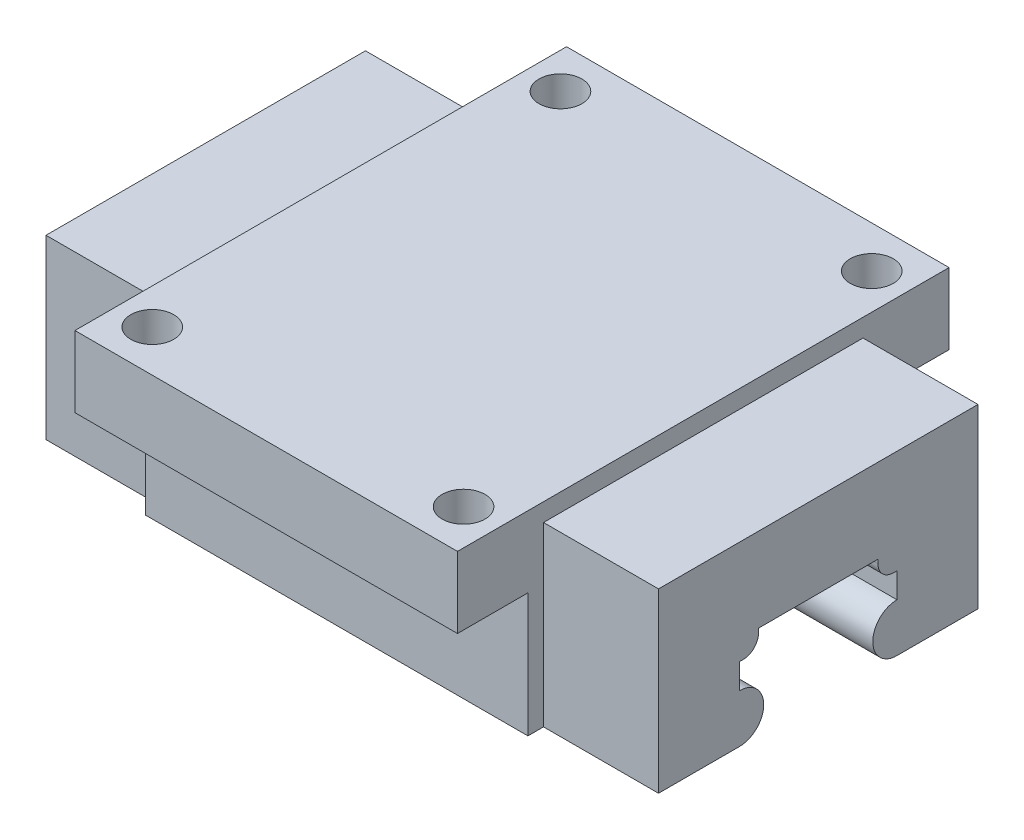
from build123d import *

# Parameters (mm, degrees)
RESSALTO_EXTRUS_O1_DEPTH = 25
ESBO_O2_R                = 2.75
CORTE_EXTRUS_O1_DEPTH    = 25
ESBO_O3_W                = 14.74
ESBO_O3_H                = 40.95
CORTE_EXTRUS_O2_DEPTH    = 2.31
CORTE_EXTRUS_O4_START    = -49.030903
ESBO_O7_W                = 9.03
ESBO_O7_H                = 15.88
CORTE_EXTRUS_O4_DEPTH    = 49.030903
CORTE_EXTRUS_O5_DEPTH    = 78.510903247


with BuildPart() as part:
    # Esboço1 → Ressalto-extrusão1 (new body)
    with BuildSketch(Plane(origin=(0, 0, 0), x_dir=(1, 0, 0), z_dir=(0, 1, 0))):
        Polygon((-24.515451624, -20.475), (-24.515451624, -31.505), (24.515451624, -31.505), (24.515451624, -20.475), (39.255451624, -20.475), (39.255451624, 20.475), (24.515451624, 20.475), (24.515451624, 31.505), (-24.515451624, 31.505), (-24.515451624, 20.475), (-39.255451624, 20.475), (-39.255451624, -20.475), align=None)
    extrude(amount=-RESSALTO_EXTRUS_O1_DEPTH)

    # Esboço2 → Corte-extrusão1 (cut)
    with BuildSketch(Plane(origin=(0, 0, 0), x_dir=(1, 0, 0), z_dir=(0, 1, 0))):
        with Locations(Location((-19.950451624, 26.16, 0), (0, 0, 270))):
            Circle(ESBO_O2_R)
        with Locations(Location((19.950451624, 26.16, 0), (0, 0, 90))):
            Circle(ESBO_O2_R)
        with Locations(Location((19.950451624, -26.16, 0), (0, 0, 270))):
            Circle(ESBO_O2_R)
        with Locations(Location((-19.950451624, -26.16, 0), (0, 0, 90))):
            Circle(ESBO_O2_R)
    extrude(amount=-CORTE_EXTRUS_O1_DEPTH, mode=Mode.SUBTRACT)

    # Esboço3 → Corte-extrusão2 (cut)
    with BuildSketch(Plane(origin=(0, 0, 0), x_dir=(1, 0, 0), z_dir=(0, 1, 0))):
        with Locations((31.885451624, 0)):
            Rectangle(ESBO_O3_W, ESBO_O3_H)
        with Locations((-31.885451624, 0)):
            Rectangle(ESBO_O3_W, ESBO_O3_H)
    extrude(amount=-CORTE_EXTRUS_O2_DEPTH, mode=Mode.SUBTRACT)

    # Esboço7 → Corte-extrusão4 (cut)
    with BuildSketch(Plane.ZY.offset(24.515451624).offset(CORTE_EXTRUS_O4_START)):
        with Locations((-26.99, -17.06)):
            Rectangle(ESBO_O7_W, ESBO_O7_H)
        with Locations((26.99, -17.06)):
            Rectangle(ESBO_O7_W, ESBO_O7_H)
    extrude(amount=CORTE_EXTRUS_O4_DEPTH, mode=Mode.SUBTRACT)

    # Esboço5 → Corte-extrusão5 (cut)
    with BuildSketch(Plane.ZY.offset(39.255451624)):
        with BuildLine():
            Line((-10.088028961, -25.000004947), (10.088017042, -25.000004947))
            ThreePointArc((10.088017042, -25.000004947), (6.988017042, -21.900004947), (10.088017042, -18.800004947))
            Line((10.088017042, -18.800004947), (10.088017042, -15.580004947))
            Line((10.088017042, -15.580004947), (9.685831834, -15.580004947))
            ThreePointArc((9.685831834, -15.580004947), (8.247865132, -15.007522497), (7.648994034, -13.580344232))
            Line((7.648994034, -13.580344232), (7.648994034, -13.080004947))
            Line((7.648994034, -13.080004947), (-7.649005954, -13.080004947))
            Line((-7.649005954, -13.080004947), (-7.649005954, -13.580344232))
            ThreePointArc((-7.649005954, -13.580344232), (-8.247877052, -15.007522497), (-9.685843753, -15.580004947))
            Line((-9.685843753, -15.580004947), (-10.088028961, -15.580004947))
            Line((-10.088028961, -15.580004947), (-10.088028961, -18.800004947))
            ThreePointArc((-10.088028961, -18.800004947), (-6.988028961, -21.900004947), (-10.088028961, -25.000004947))
        make_face()
    extrude(amount=-CORTE_EXTRUS_O5_DEPTH, mode=Mode.SUBTRACT)


solid = part.part
